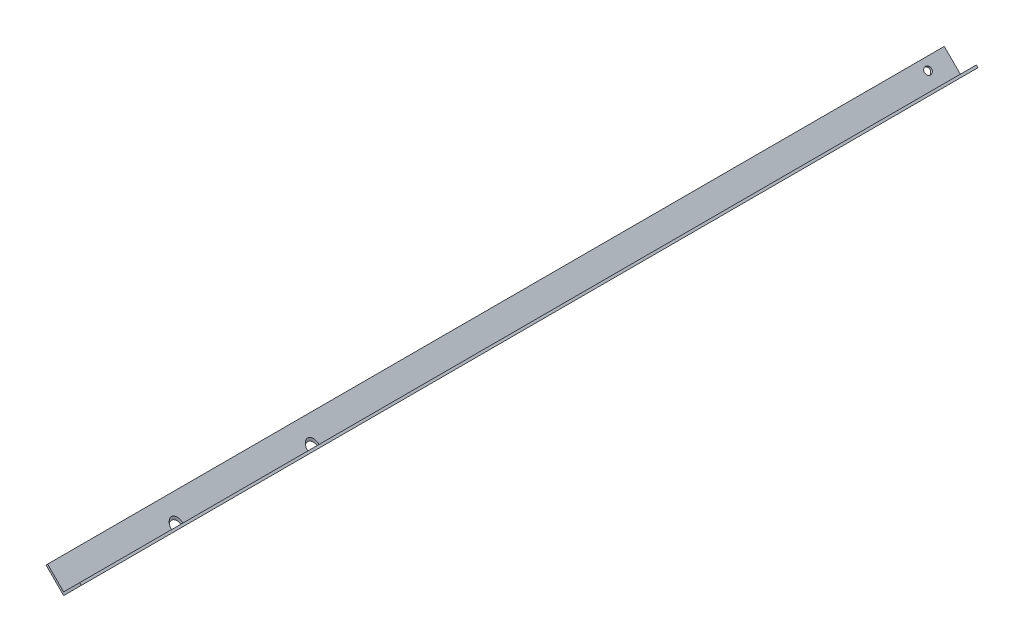
from build123d import *

# Parameters (mm, degrees)
BOSS_EXTRUDE1_DEPTH     = 501.65
SKETCH2_R               = 1.984375
CUT_EXTRUDE1_DEPTH      = 502.8276078
SKETCH3_R               = 1.984375
CUT_EXTRUDE2_DEPTH      = 502.8276078
CUT_EXTRUDE4_DEPTH      = 502.8276078
CUT_EXTRUDE4_DEPTH_BACK = 502.8276078
SKETCH4_R               = 3.175


with BuildPart() as part:
    # Sketch1 → Boss-Extrude1 (new body)
    with BuildSketch(Plane.XY):
        Polygon((0, 0), (-8.980256121, 8.980256121), (-9.878281733, 8.082230509), (0, -1.796051224), (9.878281733, 8.082230509), (8.980256121, 8.980256121), align=None)
    extrude(amount=BOSS_EXTRUDE1_DEPTH)

    # Sketch2 → Cut-Extrude1 (cut, through all)
    with BuildSketch(Plane(origin=(0, 0, 0), x_dir=(0, 0, 1), z_dir=(-0.7071067811865471, 0.7071067811865479, 0))):
        with Locations(Location((6.35, 7.62, 0), (0, 0, 270))):
            Circle(SKETCH2_R)
        with Locations(Location((19.05, 7.62, 0), (0, 0, 270))):
            Circle(SKETCH2_R)
    extrude(amount=-CUT_EXTRUDE1_DEPTH, mode=Mode.SUBTRACT)

    # Sketch3 → Cut-Extrude2 (cut, through all)
    with BuildSketch(Plane(origin=(0, 0, 0), x_dir=(0, 0, -1), z_dir=(0.7071067811865482, 0.7071067811865468, 0))):
        with Locations(Location((-12.7, 7.62, 0), (0, 0, 90))):
            Circle(SKETCH3_R)
    extrude(amount=-CUT_EXTRUDE2_DEPTH, mode=Mode.SUBTRACT)

    # Sketch4 → Cut-Extrude4 (cut, two sides: drawn at the far end of the back side and taken through both)
    with BuildSketch(Plane(origin=(0, 0, 0), x_dir=(1, 0, 0), z_dir=(0, 1, 0)).offset(-CUT_EXTRUDE4_DEPTH_BACK)):
        with Locations(Location((0, -438.15, 0), (0, 0, 270))):
            Circle(SKETCH4_R)
        with Locations(Location((0, -361.95, 0), (0, 0, 270))):
            Circle(SKETCH4_R)
    extrude(amount=CUT_EXTRUDE4_DEPTH + CUT_EXTRUDE4_DEPTH_BACK, mode=Mode.SUBTRACT)


solid = part.part
